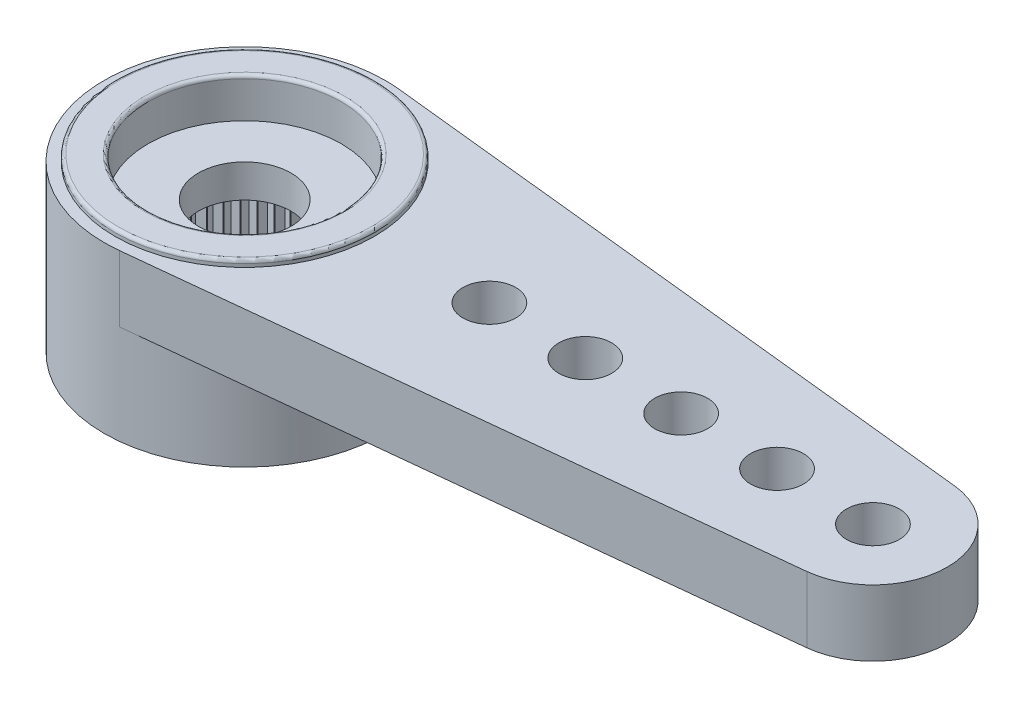
from build123d import *

# Parameters (mm, degrees)
BOSS_EXTRUDE1_DEPTH = 2
SKETCH3_R           = 3.925
SKETCH3_R_2         = 2.925
BOSS_EXTRUDE2_DEPTH = 0.2
BOSS_EXTRUDE3_START = 3
SKETCH4_R           = 4.25
BOSS_EXTRUDE3_DEPTH = 3
SKETCH5_R           = 2.9
CUT_EXTRUDE1_DEPTH  = 3
CUT_EXTRUDE2_REACH  = 24.24
SKETCH6_R           = 1.4
CUT_EXTRUDE3_START  = -1
SKETCH7_R           = 2.925
CUT_EXTRUDE3_DEPTH  = 1
CUT_EXTRUDE4_REACH  = 24.24
SKETCH8_R           = 0.8
LPATTERN1_COUNT     = 5
LPATTERN1_PITCH     = 2.9
FILLET1_R           = 0.1
CUT_EXTRUDE5_DEPTH  = 3
CIRPATTERN1_COUNT   = 50


with BuildPart() as part:
    # Sketch2 → Boss-Extrude1 (new body)
    with BuildSketch(Plane(origin=(0, 0, 0), x_dir=(1, 0, 0), z_dir=(0, 1, 0))):
        with BuildLine():
            Line((19.236842105, 2.237499903), (0.447368421, 4.226388706))
            ThreePointArc((0.447368421, 4.226388706), (-4.25, 0), (0.447368421, -4.226388706))
            Line((0.447368421, -4.226388706), (19.236842105, -2.237499903))
            ThreePointArc((19.236842105, -2.237499903), (21.25, 0), (19.236842105, 2.237499903))
        make_face()
    extrude(amount=BOSS_EXTRUDE1_DEPTH)

    # Sketch3 → Boss-Extrude2 (add)
    with BuildSketch(Plane(origin=(0, 2, 0), x_dir=(1, 0, 0), z_dir=(0, 1, 0))):
        with Locations(Location((0, 0, 0), (0, 0, 270))):
            Circle(SKETCH3_R)
        with Locations(Location((0, 0, 0), (0, 0, 270))):
            Circle(SKETCH3_R_2, mode=Mode.SUBTRACT)
    extrude(amount=BOSS_EXTRUDE2_DEPTH)

    # Sketch4 → Boss-Extrude3 (add)
    with BuildSketch(Plane.XZ.offset(BOSS_EXTRUDE3_START)):
        with Locations(Location((0, 0, 0), (0, 0, 270))):
            Circle(SKETCH4_R)
    extrude(amount=-BOSS_EXTRUDE3_DEPTH)

    # Sketch5 → Cut-Extrude1 (cut)
    with BuildSketch(Plane.XZ.offset(3)):
        with Locations(Location((0, 0, 0), (0, 0, 270))):
            Circle(SKETCH5_R)
    extrude(amount=-CUT_EXTRUDE1_DEPTH, mode=Mode.SUBTRACT)

    # Sketch6 → Cut-Extrude2 (cut, up to next)
    with BuildSketch(Plane(origin=(0, 2, 0), x_dir=(1, 0, 0), z_dir=(0, 1, 0)), mode=Mode.PRIVATE) as cut_extrude2_sk1:
        with Locations(Location((0, 0, 0), (0, 0, 270))):
            Circle(SKETCH6_R)
    cut_extrude2_tool1 = extrude(cut_extrude2_sk1.sketch, amount=-CUT_EXTRUDE2_REACH, mode=Mode.PRIVATE) & part.part
    add(cut_extrude2_tool1.solids().sort_by_distance((0, 2, 0))[0], mode=Mode.SUBTRACT)

    # Sketch7 → Cut-Extrude3 (cut)
    with BuildSketch(Plane(origin=(0, 2, 0), x_dir=(1, 0, 0), z_dir=(0, 1, 0)).offset(CUT_EXTRUDE3_START)):
        with Locations(Location((0, 0, 0), (0, 0, 270))):
            Circle(SKETCH7_R)
    extrude(amount=CUT_EXTRUDE3_DEPTH, mode=Mode.SUBTRACT)

    # Sketch8 → Cut-Extrude4 (cut, up to next)
    with BuildSketch(Plane(origin=(0, 2, 0), x_dir=(1, 0, 0), z_dir=(0, 1, 0)), mode=Mode.PRIVATE) as cut_extrude4_sk1:
        with Locations(Location((19, 0, 0), (0, 0, 270))):
            Circle(SKETCH8_R)
    cut_extrude4_tool1 = extrude(cut_extrude4_sk1.sketch, amount=-CUT_EXTRUDE4_REACH, mode=Mode.PRIVATE) & part.part
    cut_extrude4 = cut_extrude4_tool1.solids().sort_by_distance((19, 2, 0))[0]
    add(cut_extrude4, mode=Mode.SUBTRACT)

    # LPattern1: Cut-Extrude4 ×5
    with Locations(*[(-i * LPATTERN1_PITCH, 0, 0) for i in range(1, LPATTERN1_COUNT)]):
        add(cut_extrude4, mode=Mode.SUBTRACT)

    # Fillet1
    fillet1_edges = [part.edges().sort_by_distance(p)[0] for p in [
        (0, 2.2, -3.925),
        (0, 2.2, -2.925),
    ]]
    fillet(fillet1_edges, radius=FILLET1_R)

    # Sketch9 → Cut-Extrude5 (cut)
    with BuildSketch(Plane.XZ.offset(3)):
        Polygon((0, 3.1), (-0.25, 2.8), (0.25, 2.8), align=None)
    cut_extrude5 = extrude(amount=-CUT_EXTRUDE5_DEPTH, mode=Mode.SUBTRACT)

    # CirPattern1: Cut-Extrude5 ×50 about axis
    cirpattern1_axis = Axis((0, 0, 0), (0, 1, 0))
    for i in range(1, CIRPATTERN1_COUNT):
        add(cut_extrude5.rotate(cirpattern1_axis, i * 360 / CIRPATTERN1_COUNT), mode=Mode.SUBTRACT)


solid = part.part
